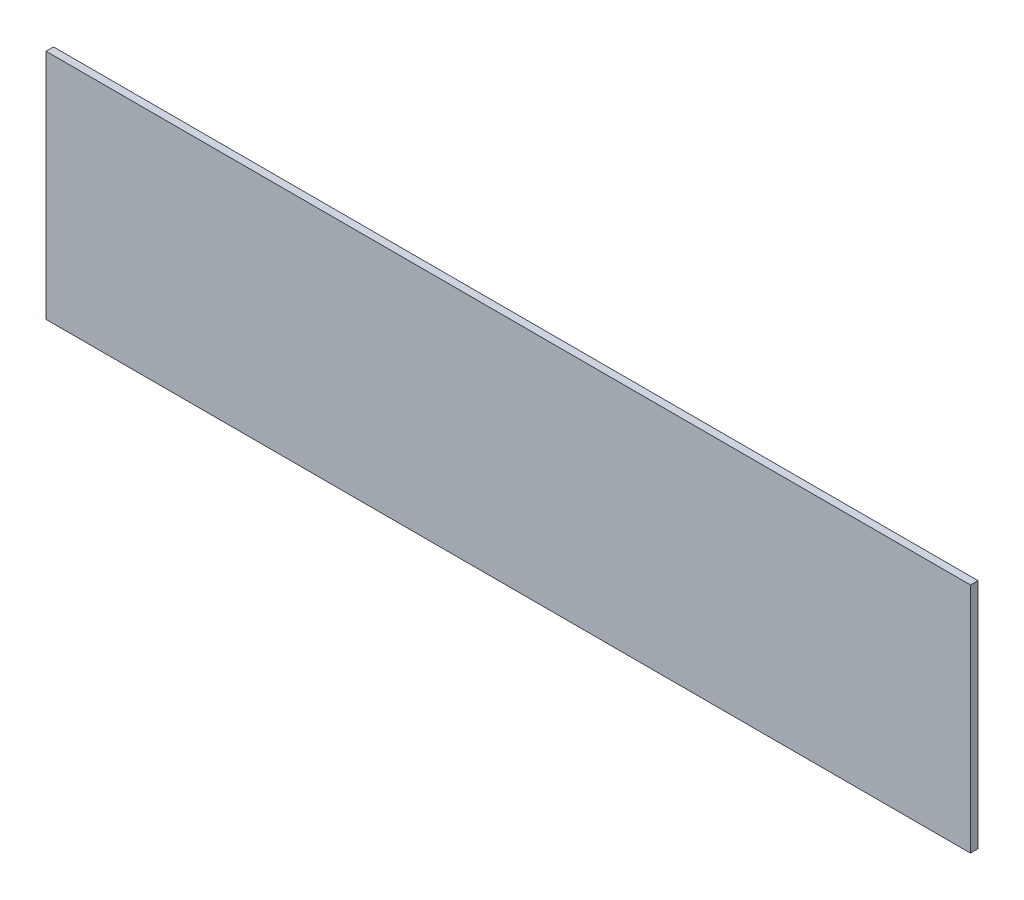
from build123d import *

# Parameters (mm, degrees)
SKETCH1_W           = 1230
SKETCH1_H           = 309
BOSS_EXTRUDE1_DEPTH = 10


with BuildPart() as part:
    # Sketch1 → Boss-Extrude1 (new body)
    with BuildSketch(Plane.XY):
        with Locations((615, 154.5)):
            Rectangle(SKETCH1_W, SKETCH1_H)
    extrude(amount=BOSS_EXTRUDE1_DEPTH)


solid = part.part
